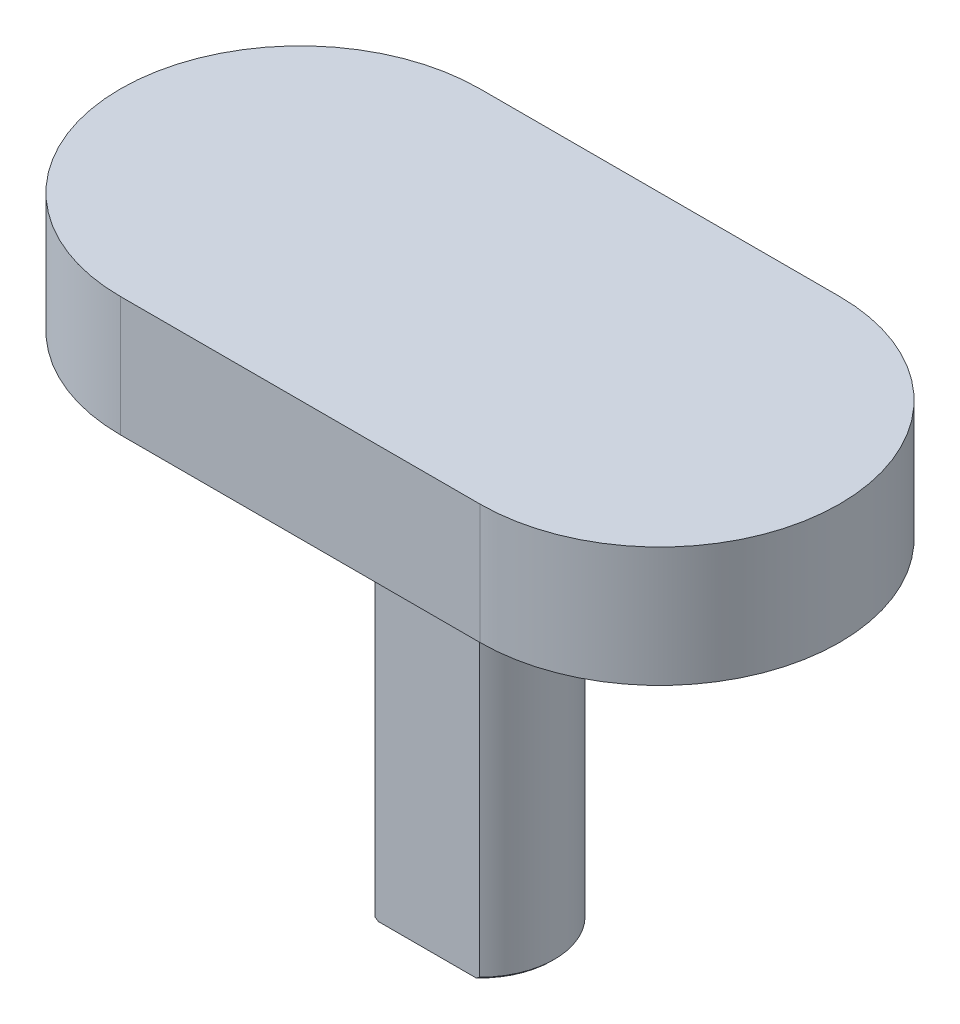
from build123d import *

# Parameters (mm, degrees)
EXTRUDE_1_DEPTH        = 50
CUT_EXTRUDE_1_DEPTH    = 40
EXTRUDE_2_DEPTH        = 20
EXTRUDE_3_DEPTH        = 195
SKETCH_6_R             = 11
CUT_EXTRUDE_2_DEPTH    = 15
SKETCH_7_R             = 18
CUT_EXTRUDE_3_DEPTH    = 200
HOLE_WIZARD_M6_1_D     = 5
HOLE_WIZARD_M6_1_DEPTH = 13
HOLE_WIZARD_M6_1_TIP   = 1.502151548
CHAMFER_1_SIZE         = 1


with BuildPart() as part:
    # 草图1 → 凸台-拉伸1 (new body)
    with BuildSketch(Plane(origin=(0, 0, 0), x_dir=(1, 0, 0), z_dir=(0, 1, 0))):
        with BuildLine():
            Line((-75, 75), (75, 75))
            ThreePointArc((75, 75), (150, 0), (75, -75))
            Line((75, -75), (-75, -75))
            ThreePointArc((-75, -75), (-150, 0), (-75, 75))
        make_face()
    extrude(amount=EXTRUDE_1_DEPTH)

    # 草图2 → 切除-拉伸1 (cut)
    with BuildSketch(Plane.XZ):
        with BuildLine():
            Line((-75, 65), (75, 65))
            ThreePointArc((75, 65), (140, 0), (75, -65))
            Line((75, -65), (-75, -65))
            ThreePointArc((-75, -65), (-140, 0), (-75, 65))
        make_face()
    extrude(amount=-CUT_EXTRUDE_1_DEPTH, mode=Mode.SUBTRACT)

    # 草图4 → 凸台-拉伸2 (add)
    with BuildSketch(Plane.XZ.offset(-40)):
        with BuildLine():
            Line((-24.919871589, 30), (24.919871589, 30))
            ThreePointArc((24.919871589, 30), (39, 0), (24.919871589, -30))
            Line((24.919871589, -30), (-24.919871589, -30))
            ThreePointArc((-24.919871589, -30), (-39, 0), (-24.919871589, 30))
        make_face()
    extrude(amount=EXTRUDE_2_DEPTH)

    # 草图5 → 凸台-拉伸3 (add)
    with BuildSketch(Plane.XZ.offset(-20)):
        with BuildLine():
            Line((-21.840329668, 22), (21.840329668, 22))
            ThreePointArc((21.840329668, 22), (31, 0), (21.840329668, -22))
            Line((21.840329668, -22), (-21.840329668, -22))
            ThreePointArc((-21.840329668, -22), (-31, 0), (-21.840329668, 22))
        make_face()
    extrude(amount=EXTRUDE_3_DEPTH)

    # 草图6 → 切除-拉伸2 (cut)
    with BuildSketch(Plane.XZ.offset(175)):
        with Locations(Location((0, 0, 0), (0, 0, 270))):
            Circle(SKETCH_6_R)
    extrude(amount=-CUT_EXTRUDE_2_DEPTH, mode=Mode.SUBTRACT)

    # 草图7 → 切除-拉伸3 (cut)
    with BuildSketch(Plane(origin=(0, -160, 0), x_dir=(1, 0, 0), z_dir=(0, 1, 0))):
        with Locations(Location((0, 0, 0), (0, 0, 270))):
            Circle(SKETCH_7_R)
    extrude(amount=CUT_EXTRUDE_3_DEPTH, mode=Mode.SUBTRACT)

    # M6 螺纹孔1
    with Locations(Plane(origin=(0, -175, 0), x_dir=(-1, 0, 0), z_dir=(0, -1, 0))):
        with Locations((24.5, 0), (17.324116139, -17.324116139), (-17.324116139, -17.324116139), (-24.5, 0), (-17.324116139, 17.324116139), (17.324116139, 17.324116139)):
            Hole(HOLE_WIZARD_M6_1_D / 2, depth=HOLE_WIZARD_M6_1_DEPTH)
            with Locations((0, 0, -(HOLE_WIZARD_M6_1_DEPTH + HOLE_WIZARD_M6_1_TIP / 2))):  # 118° drill point
                Cone(0, HOLE_WIZARD_M6_1_D / 2, HOLE_WIZARD_M6_1_TIP, mode=Mode.SUBTRACT)

    # 倒角1
    chamfer_1_edges = [part.edges().sort_by_distance(p)[0] for p in [
        (-31, -175, 0),
        (31, -175, 0),
    ]]
    chamfer(chamfer_1_edges, length=CHAMFER_1_SIZE)


solid = part.part
